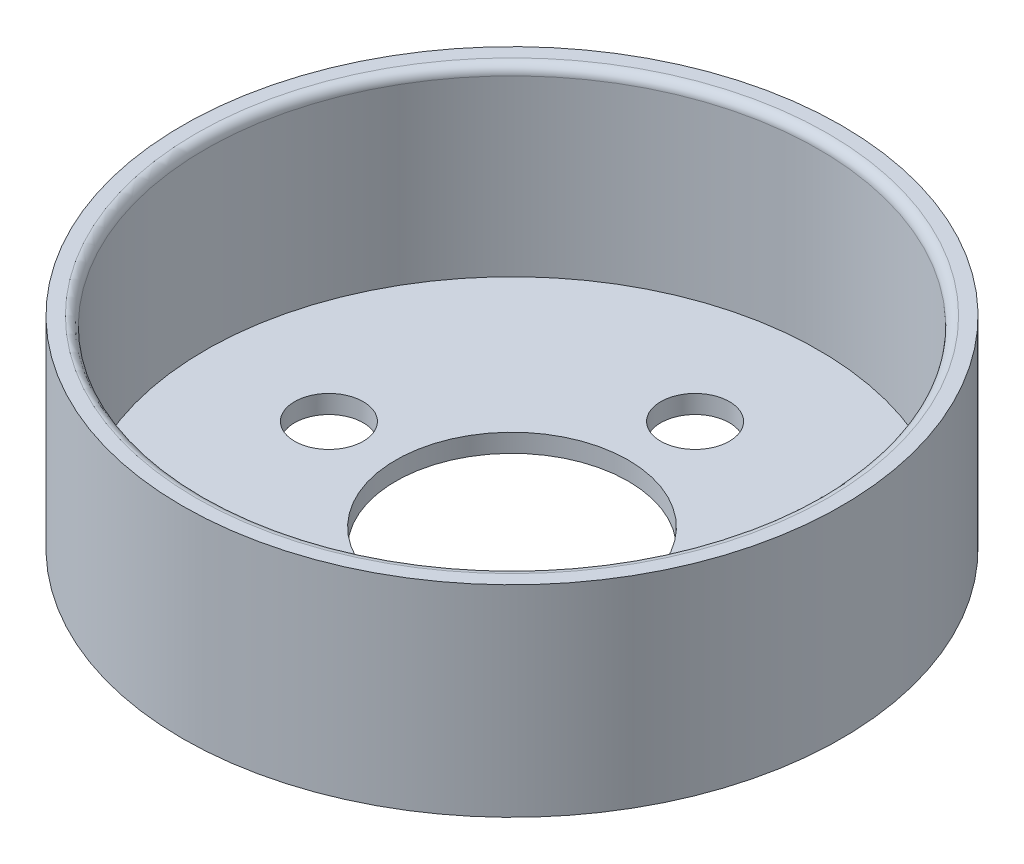
from build123d import *

# Parameters (mm, degrees)
SKETCH1_R           = 45.72
SKETCH1_R_2         = 42.545
BOSS_EXTRUDE1_DEPTH = 2.54
SKETCH2_R           = 45.72
SKETCH2_R_2         = 42.545
BOSS_EXTRUDE2_DEPTH = 25.4
CUT_EXTRUDE1_REACH  = 72.436
SKETCH3_R           = 16.129
FILLET1_R           = 1.27
CUT_EXTRUDE2_REACH  = 71.468
SKETCH5_R           = 4.7625
CIRPATTERN1_COUNT   = 4


with BuildPart() as part:
    # Sketch1 → Boss-Extrude1 (new body)
    # profile 1 of 2: a face of its own
    with BuildSketch(Plane(origin=(0, 0, 0), x_dir=(1, 0, 0), z_dir=(0, 1, 0))):
        with Locations(Location((0, 0, 0), (0, 0, 270))):
            Circle(SKETCH1_R)
        Circle(SKETCH1_R_2, mode=Mode.SUBTRACT)
    # profile 2 of 2: a face of its own
    with BuildSketch(Plane(origin=(0, 0, 0), x_dir=(1, 0, 0), z_dir=(0, 1, 0))):
        Circle(SKETCH1_R_2)
    extrude(amount=BOSS_EXTRUDE1_DEPTH)

    # Sketch2 → Boss-Extrude2 (add)
    with BuildSketch(Plane(origin=(0, 2.54, 0), x_dir=(1, 0, 0), z_dir=(0, 1, 0))):
        with Locations(Location((0, 0, 0), (0, 0, 270))):
            Circle(SKETCH2_R)
        with Locations(Location((0, 0, 0), (0, 0, 270))):
            Circle(SKETCH2_R_2, mode=Mode.SUBTRACT)
    extrude(amount=BOSS_EXTRUDE2_DEPTH)

    # Sketch3 → Cut-Extrude1 (cut, up to next)
    with BuildSketch(Plane.XZ, mode=Mode.PRIVATE) as cut_extrude1_sk1:
        with Locations(Location((0, 0, 0), (0, 0, 270))):
            Circle(SKETCH3_R)
    cut_extrude1_tool1 = extrude(cut_extrude1_sk1.sketch, amount=-CUT_EXTRUDE1_REACH, mode=Mode.PRIVATE) & part.part
    add(cut_extrude1_tool1.solids().sort_by_distance((0, 0, 0))[0], mode=Mode.SUBTRACT)

    # Fillet1
    fillet1_edges = [part.edges().sort_by_distance(p)[0] for p in [
        (0, 27.94, -42.545),
    ]]
    fillet(fillet1_edges, radius=FILLET1_R)

    # Sketch5 → Cut-Extrude2 (cut, up to next)
    with BuildSketch(Plane(origin=(0, 2.54, 0), x_dir=(1, 0, 0), z_dir=(0, 1, 0)), mode=Mode.PRIVATE) as cut_extrude2_sk1:
        with Locations(Location((0, 25.4, 0), (0, 0, 270))):
            Circle(SKETCH5_R)
    cut_extrude2_tool1 = extrude(cut_extrude2_sk1.sketch, amount=-CUT_EXTRUDE2_REACH, mode=Mode.PRIVATE) & part.part
    cut_extrude2 = cut_extrude2_tool1.solids().sort_by_distance((0, 2.54, -25.4))[0]
    add(cut_extrude2, mode=Mode.SUBTRACT)

    # CirPattern1: Cut-Extrude2 ×4 about axis
    cirpattern1_axis = Axis((0, 0, 0), (0, 1, 0))
    for i in range(1, CIRPATTERN1_COUNT):
        add(cut_extrude2.rotate(cirpattern1_axis, i * 360 / CIRPATTERN1_COUNT), mode=Mode.SUBTRACT)


solid = part.part
